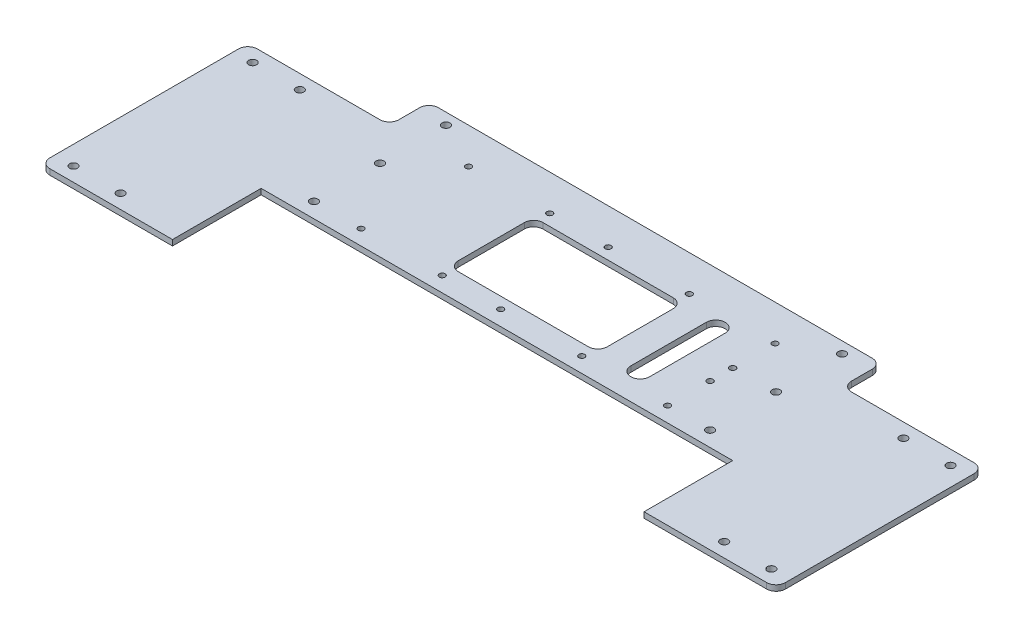
from build123d import *

# Parameters (mm, degrees)
SKETCH_1_W          = 240
SKETCH_1_H          = 166
EXTRUDE_1272_DEPTH  = 3
SKETCH_4_R          = 2.1
SKETCH_4_R_2        = 1.55
CUT_EXTRUDE_3_DEPTH = 251.068459046
SKETCH_5_R          = 1.55
SKETCH_5_R_2        = 10
SKETCH_5_W          = 79
SKETCH_5_H          = 45
CUT_EXTRUDE_4_DEPTH = 251.068459046
SKETCH_6_W          = 75
SKETCH_6_H          = 110
SKETCH_6_R          = 2.1
EXTRUDE_1_DEPTH     = 3
FILLET_1_R          = 5
SKETCH_8_R          = 39
CUT_EXTRUDE_6_DEPTH = 10
CUT_EXTRUDE_START   = -10
SKETCH_9_R          = 1.55
SKETCH_9_R_2        = 1.6
CUT_EXTRUDE_7_DEPTH = 10
SKETCH_10_W         = 250
SKETCH_10_H         = 82
CUT_EXTRUDE_8_DEPTH = 10


with BuildPart() as part:
    # 草图1 → Extrude 1272 (new body)
    with BuildSketch(Plane(origin=(0, 0, 0), x_dir=(1, 0, 0), z_dir=(0, 1, 0))):
        with Locations((31.575924772, -115.871750732)):
            Rectangle(SKETCH_1_W, SKETCH_1_H)
    extrude(amount=EXTRUDE_1272_DEPTH)

    # 草图4 → 切除-拉伸3 (cut, through all)
    with BuildSketch(Plane(origin=(0, 3, 0), x_dir=(1, 0, 0), z_dir=(0, 1, 0))):
        with Locations(Location((-73.424075228, -73.871750732, 0), (0, 0, 270))):
            Circle(SKETCH_4_R)
        with Locations(Location((136.575924772, -178.871750732, 0), (0, 0, 90))):
            Circle(SKETCH_4_R)
        with Locations(Location((-73.424075228, -108.871750732, 0), (0, 0, 270))):
            Circle(SKETCH_4_R)
        with Locations(Location((-73.424075228, -143.871750732, 0), (0, 0, 270))):
            Circle(SKETCH_4_R)
        with Locations(Location((-73.424075228, -178.871750732, 0), (0, 0, 270))):
            Circle(SKETCH_4_R)
        with Locations(Location((136.575924772, -143.871750732, 0), (0, 0, 90))):
            Circle(SKETCH_4_R)
        with Locations(Location((136.575924772, -108.871750732, 0), (0, 0, 90))):
            Circle(SKETCH_4_R)
        with Locations(Location((136.575924772, -73.871750732, 0), (0, 0, 90))):
            Circle(SKETCH_4_R)
        with Locations(Location((-73.424075228, -38.871750732, 0), (0, 0, 270))):
            Circle(SKETCH_4_R)
        with Locations(Location((136.575924772, -38.871750732, 0), (0, 0, 90))):
            Circle(SKETCH_4_R)
        with Locations(Location((77.075924772, -188.871750732, 0), (0, 0, 270))):
            Circle(SKETCH_4_R_2)
        with Locations(Location((-13.924075228, -188.871750732, 0), (0, 0, 90))):
            Circle(SKETCH_4_R_2)
        with Locations(Location((77.075924772, -153.871750732, 0), (0, 0, 270))):
            Circle(SKETCH_4_R_2)
        with Locations(Location((-13.924075228, -153.871750732, 0), (0, 0, 90))):
            Circle(SKETCH_4_R_2)
    extrude(amount=-CUT_EXTRUDE_3_DEPTH, mode=Mode.SUBTRACT)

    # 草图5 → 切除-拉伸4 (cut, through all)
    with BuildSketch(Plane(origin=(0, 3, 0), x_dir=(1, 0, 0), z_dir=(0, 1, 0))):
        with Locations(Location((-5.424075228, -51.871750732, 0), (0, 0, 270))):
            Circle(SKETCH_5_R)
        with Locations(Location((68.575924772, -51.871750732, 0), (0, 0, 90))):
            Circle(SKETCH_5_R)
        with Locations(Location((68.575924772, -108.871750732, 0), (0, 0, 270))):
            Circle(SKETCH_5_R)
        with Locations(Location((-5.424075228, -108.871750732, 0), (0, 0, 90))):
            Circle(SKETCH_5_R)
        with Locations(Location((-45.424075228, -143.871750732, 0), (0, 0, 270))):
            Circle(SKETCH_5_R_2)
        with Locations(Location((108.575924772, -143.871750732, 0), (0, 0, 90))):
            Circle(SKETCH_5_R_2)
        with Locations((31.575924772, -80.371750732)):
            Rectangle(SKETCH_5_W, SKETCH_5_H)
        with BuildLine():
            Line((86.075924772, -100.371750732), (86.075924772, -60.371750732))
            ThreePointArc((86.075924772, -60.371750732), (91.075924772, -55.371750732), (96.075924772, -60.371750732))
            Line((96.075924772, -60.371750732), (96.075924772, -100.371750732))
            ThreePointArc((96.075924772, -100.371750732), (91.075924772, -105.371750732), (86.075924772, -100.371750732))
        make_face()
        with BuildLine():
            Line((1.575924772, -117.871750732), (61.575924772, -117.871750732))
            ThreePointArc((61.575924772, -117.871750732), (68.575924772, -124.871750732), (61.575924772, -131.871750732))
            Line((61.575924772, -131.871750732), (41.575924772, -131.871750732))
            ThreePointArc((41.575924772, -131.871750732), (31.575924772, -141.871750732), (21.575924772, -131.871750732))
            Line((21.575924772, -131.871750732), (1.575924772, -131.871750732))
            ThreePointArc((1.575924772, -131.871750732), (-5.424075228, -124.871750732), (1.575924772, -117.871750732))
        make_face()
    extrude(amount=-CUT_EXTRUDE_4_DEPTH, mode=Mode.SUBTRACT)

    # 草图6 → 凸台-拉伸1 (add)
    # profile 1 of 2: a face of its own
    with BuildSketch(Plane(origin=(0, 0, 0), x_dir=(1, 0, 0), z_dir=(0, 1, 0))):
        with Locations((-125.924075228, -108.871750732)):
            Rectangle(SKETCH_6_W, SKETCH_6_H)
        with Locations(Location((-153.424075228, -61.371750732, 0), (0, 0, 270))):
            Circle(SKETCH_6_R, mode=Mode.SUBTRACT)
        with Locations(Location((-153.424075228, -156.371750732, 0), (0, 0, 90))):
            Circle(SKETCH_6_R, mode=Mode.SUBTRACT)
        with Locations(Location((-128.424075228, -61.371750732, 0), (0, 0, 270))):
            Circle(SKETCH_6_R, mode=Mode.SUBTRACT)
        with Locations(Location((-128.424075228, -156.371750732, 0), (0, 0, 90))):
            Circle(SKETCH_6_R, mode=Mode.SUBTRACT)
    # profile 2 of 2: a face of its own
    with BuildSketch(Plane(origin=(0, 0, 0), x_dir=(1, 0, 0), z_dir=(0, 1, 0))):
        with Locations((189.075924772, -108.871750732)):
            Rectangle(SKETCH_6_W, SKETCH_6_H)
        with Locations(Location((216.575924772, -156.371750732, 0), (0, 0, 270))):
            Circle(SKETCH_6_R, mode=Mode.SUBTRACT)
        with Locations(Location((216.575924772, -61.371750732, 0), (0, 0, 90))):
            Circle(SKETCH_6_R, mode=Mode.SUBTRACT)
        with Locations(Location((191.575924772, -156.371750732, 0), (0, 0, 270))):
            Circle(SKETCH_6_R, mode=Mode.SUBTRACT)
        with Locations(Location((191.575924772, -61.371750732, 0), (0, 0, 90))):
            Circle(SKETCH_6_R, mode=Mode.SUBTRACT)
    extrude(amount=EXTRUDE_1_DEPTH)

    # 圆角1
    fillet_1_edges = [part.edges().sort_by_distance(p)[0] for p in [
        (41.575924772, 1.5, 131.871750732),
        (21.575924772, 1.5, 131.871750732),
        (-7.924075228, 1.5, 102.871750732),
        (-7.924075228, 1.5, 57.871750732),
        (71.075924772, 1.5, 57.871750732),
        (71.075924772, 1.5, 102.871750732),
        (-88.424075228, 1.5, 163.871750732),
        (-88.424075228, 1.5, 53.871750732),
        (-163.424075228, 1.5, 53.871750732),
        (-163.424075228, 1.5, 163.871750732),
        (226.575924772, 1.5, 53.871750732),
        (151.575924772, 1.5, 53.871750732),
        (151.575924772, 1.5, 163.871750732),
        (226.575924772, 1.5, 163.871750732),
        (-88.424075228, 1.5, 198.871750732),
        (-88.424075228, 1.5, 32.871750732),
        (151.575924772, 1.5, 32.871750732),
        (151.575924772, 1.5, 198.871750732),
    ]]
    fillet(fillet_1_edges, radius=FILLET_1_R)

    # 草图8 → 切除-拉伸6 (cut)
    with BuildSketch(Plane(origin=(0, 3, 0), x_dir=(1, 0, 0), z_dir=(0, 1, 0))):
        with Locations((31.575924772, -158.205226673)):
            Circle(SKETCH_8_R)
    extrude(amount=-CUT_EXTRUDE_6_DEPTH, mode=Mode.SUBTRACT)

    # 草图9 → 切除-拉伸7 (cut)
    with BuildSketch(Plane.XZ.offset(CUT_EXTRUDE_START)):
        with Locations(Location((68.575924772, 108.871750732, 0), (0, 0, 90))):
            Circle(SKETCH_9_R)
        with Locations(Location((-48.424075228, 108.871750732, 0), (0, 0, 270))):
            Circle(SKETCH_9_R)
        with Locations(Location((25.575924772, 108.871750732, 0), (0, 0, 270))):
            Circle(SKETCH_9_R)
        with Locations(Location((25.575924772, 51.871750732, 0), (0, 0, 90))):
            Circle(SKETCH_9_R)
        with Locations(Location((-48.424075228, 51.871750732, 0), (0, 0, 90))):
            Circle(SKETCH_9_R)
        with Locations(Location((114.075924772, 51.871750732, 0), (0, 0, 270))):
            Circle(SKETCH_9_R)
        with Locations(Location((114.075924772, 74.371750732, 0), (0, 0, 270))):
            Circle(SKETCH_9_R_2)
        with Locations(Location((114.075924772, 86.371750732, 0), (0, 0, 90))):
            Circle(SKETCH_9_R_2)
        with Locations(Location((114.075924772, 108.871750732, 0), (0, 0, 90))):
            Circle(SKETCH_9_R)
        with Locations(Location((114.075924772, 131.371750732, 0), (0, 0, 270))):
            Circle(SKETCH_9_R_2)
        with Locations(Location((68.075924772, 131.371750732, 0), (0, 0, 90))):
            Circle(SKETCH_9_R_2)
    extrude(amount=CUT_EXTRUDE_7_DEPTH, mode=Mode.SUBTRACT)

    # 草图10 → 切除-拉伸8 (cut)
    with BuildSketch(Plane.XZ):
        with Locations((31.575924772, 157.871750732)):
            Rectangle(SKETCH_10_W, SKETCH_10_H)
    extrude(amount=-CUT_EXTRUDE_8_DEPTH, mode=Mode.SUBTRACT)


solid = part.part
